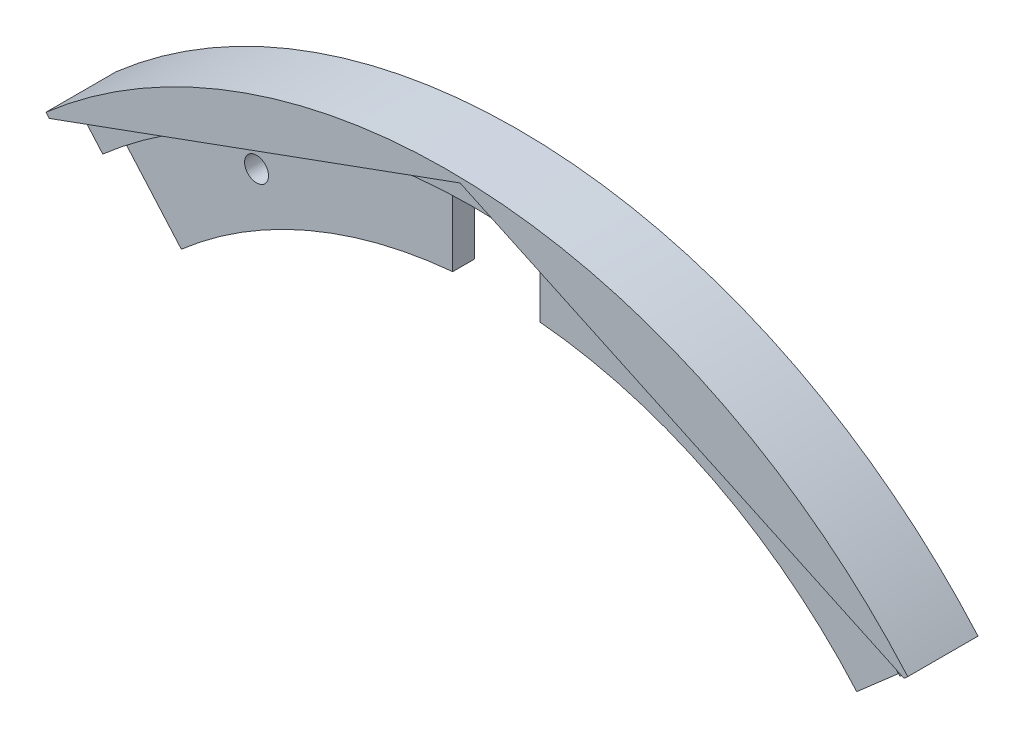
from build123d import *

# Parameters (mm, degrees)
BOSS_EXTRUDE1_DEPTH = 6.1
BOSS_EXTRUDE4_START = -5
BOSS_EXTRUDE4_DEPTH = 5
BOSS_EXTRUDE5_START = 5
SKETCH6_R           = 2.75
BOSS_EXTRUDE5_DEPTH = 5
SKETCH7_R           = 2.75
CUT_EXTRUDE1_DEPTH  = 176.534516689


with BuildPart() as part:
    # Sketch4 → Boss-Extrude1 (new body)
    with BuildSketch(Plane.XY):
        with BuildLine():
            Line((2.791805242, 138.827155544), (104.55323324, 91.375022364))
            Line((104.55323324, 91.375022364), (105.415210237, 92.128353131))
            ThreePointArc((105.415210237, 92.128353131), (9.395226761, 139.684393237), (-92.128353131, 105.415210237))
            Line((-92.128353131, 105.415210237), (-91.375022364, 104.55323324))
            Line((-91.375022364, 104.55323324), (2.791805242, 138.827155544))
        make_face()
    extrude(amount=BOSS_EXTRUDE1_DEPTH)

    # Sketch5 → Boss-Extrude4 (add)
    with BuildSketch(Plane.XY.offset(BOSS_EXTRUDE4_START)):
        with BuildLine():
            Line((30.722164617, 125.803015072), (76.622873865, 104.399162835))
            ThreePointArc((76.622873865, 104.399162835), (87.59255508, 95.382358403), (97.50906947, 85.218726646))
            Line((97.50906947, 85.218726646), (105.415210237, 92.128353131))
            ThreePointArc((105.415210237, 92.128353131), (9.395226761, 139.684393237), (-92.128353131, 105.415210237))
            Line((-92.128353131, 105.415210237), (-85.218726646, 97.50906947))
            ThreePointArc((-85.218726646, 97.50906947), (-30.701883618, 125.807966132), (30.722164617, 125.803015072))
        make_face()
    extrude(amount=BOSS_EXTRUDE4_DEPTH)

    # Sketch6 → Boss-Extrude5 (add)
    with BuildSketch(Plane(origin=(0, 0, -5), x_dir=(-1, 0, 0), z_dir=(0, 0, -1)).offset(BOSS_EXTRUDE5_START)):
        with BuildLine():
            Line((-10, 129.5), (10, 129.5))
            Line((10, 129.5), (10, 109.268365161))
            ThreePointArc((10, 109.268365161), (43.208620922, 100.85926186), (72.205596766, 82.619171024))
            Line((72.205596766, 82.619171024), (92.128353131, 105.415210237))
            ThreePointArc((92.128353131, 105.415210237), (-9.395226761, 139.684393237), (-105.415210237, 92.128353131))
            Line((-105.415210237, 92.128353131), (-82.619171024, 72.205596766))
            ThreePointArc((-82.619171024, 72.205596766), (-49.879754516, 97.732214313), (-10, 109.268365161))
            Line((-10, 109.268365161), (-10, 129.5))
        make_face()
        with Locations((54.966796439, 107.162966034)):
            Circle(SKETCH6_R, mode=Mode.SUBTRACT)
    extrude(amount=-BOSS_EXTRUDE5_DEPTH)

    # Sketch7 → Cut-Extrude1 (cut, through all)
    with BuildSketch(Plane.XY):
        with Locations((76.813119358, 91.542310953)):
            Circle(SKETCH7_R)
    extrude(amount=-CUT_EXTRUDE1_DEPTH, mode=Mode.SUBTRACT)


solid = part.part
